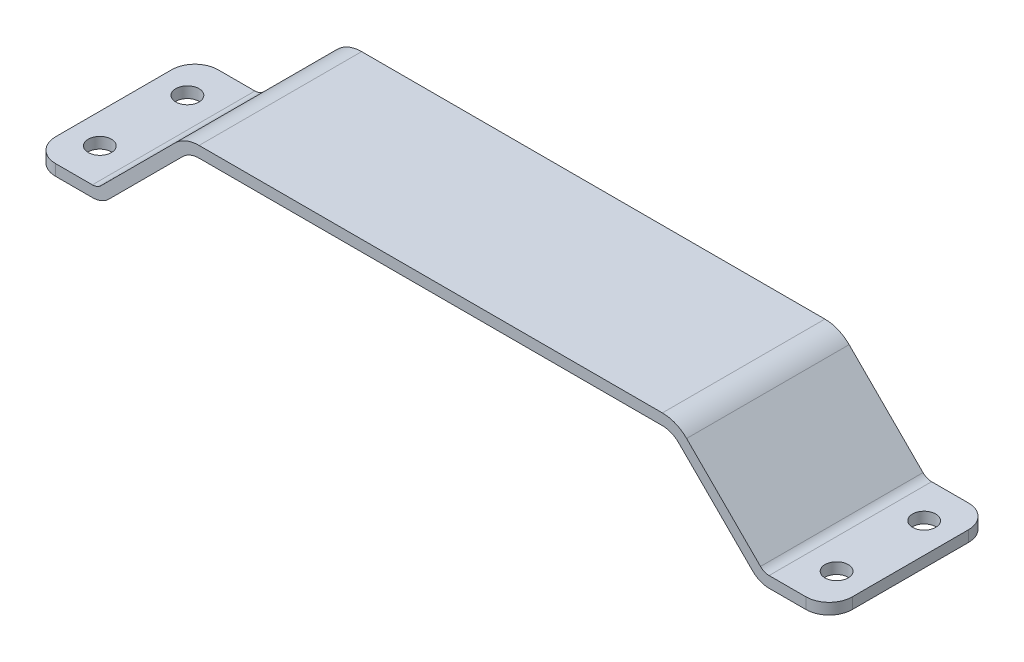
from build123d import *

# Parameters (mm, degrees)
BOSS_EXTRUDE1_DEPTH = 70
FILLET1_R           = 10
SKETCH2_R           = 5
CUT_EXTRUDE1_DEPTH  = 10


with BuildPart() as part:
    # Sketch1 → Boss-Extrude1 (new body)
    with BuildSketch(Plane.XY):
        with BuildLine():
            Line((110.200913438, 15.404640081), (142.020718591, -16.415165072))
            ThreePointArc((142.020718591, -16.415165072), (143.720696939, -17.551054289), (145.725958124, -17.949925539))
            Line((145.725958124, -17.949925539), (171.583822501, -17.949925539))
            Line((171.583822501, -17.949925539), (171.583822501, -22.709925539))
            Line((171.583822501, -22.709925539), (145.725958124, -22.709925539))
            ThreePointArc((145.725958124, -22.709925539), (141.899123801, -21.948720864), (138.654890312, -19.780993351))
            Line((138.654890312, -19.780993351), (106.835085159, 12.038811802))
            ThreePointArc((106.835085159, 12.038811802), (103.590851671, 14.206539316), (99.764017347, 14.967743991))
            Line((99.764017347, 14.967743991), (12.581613091, 14.967743991))
            Line((12.581613091, 14.967743991), (-99.764017347, 14.967743991))
            ThreePointArc((-99.764017347, 14.967743991), (-103.590851671, 14.206539316), (-106.835085159, 12.038811802))
            Line((-106.835085159, 12.038811802), (-138.654890312, -19.780993351))
            ThreePointArc((-138.654890312, -19.780993351), (-141.899123801, -21.948720864), (-145.725958124, -22.709925539))
            Line((-145.725958124, -22.709925539), (-171.583822501, -22.709925539))
            Line((-171.583822501, -22.709925539), (-171.583822501, -17.949925539))
            Line((-171.583822501, -17.949925539), (-145.725958124, -17.949925539))
            ThreePointArc((-145.725958124, -17.949925539), (-143.720696939, -17.551054289), (-142.020718591, -16.415165072))
            Line((-142.020718591, -16.415165072), (-110.200913438, 15.404640081))
            ThreePointArc((-110.200913438, 15.404640081), (-105.412424809, 18.60420589), (-99.764017347, 19.727743991))
            Line((-99.764017347, 19.727743991), (12.581613091, 19.727743991))
            Line((12.581613091, 19.727743991), (99.764017347, 19.727743991))
            ThreePointArc((99.764017347, 19.727743991), (105.412424809, 18.60420589), (110.200913438, 15.404640081))
        make_face()
    extrude(amount=-BOSS_EXTRUDE1_DEPTH)

    # Fillet1
    fillet1_edges = [part.edges().sort_by_distance(p)[0] for p in [
        (171.583822501, -20.329925539, 0),
        (-171.583822501, -20.329925539, 0),
        (-171.583822501, -20.329925539, -70),
        (171.583822501, -20.329925539, -70),
    ]]
    fillet(fillet1_edges, radius=FILLET1_R)

    # Sketch2 → Cut-Extrude1 (cut)
    with BuildSketch(Plane(origin=(0, -17.949925539, 0), x_dir=(1, 0, 0), z_dir=(0, 1, 0))):
        with BuildLine():
            ThreePointArc((153.654890312, 53.854773815), (158.654890312, 48.854773815), (163.654890312, 53.854773815))
            Line((163.654890312, 53.854773815), (153.654890312, 53.854773815))
        make_face()
        with BuildLine():
            Line((153.654890312, 53.854773815), (163.654890312, 53.854773815))
            ThreePointArc((163.654890312, 53.854773815), (158.654890312, 58.854773815), (153.654890312, 53.854773815))
        make_face()
        with Locations(Location((158.654890312, 16.145226185, 0), (0, 0, 180))):
            Circle(SKETCH2_R)
    cut_extrude1 = extrude(amount=-CUT_EXTRUDE1_DEPTH, mode=Mode.SUBTRACT)

    # Mirror1: Cut-Extrude1 across plane
    add(cut_extrude1.mirror(Plane(origin=(0, 0, 0), x_dir=(0, 0, 1), z_dir=(1, 0, 0))), mode=Mode.SUBTRACT)


solid = part.part
